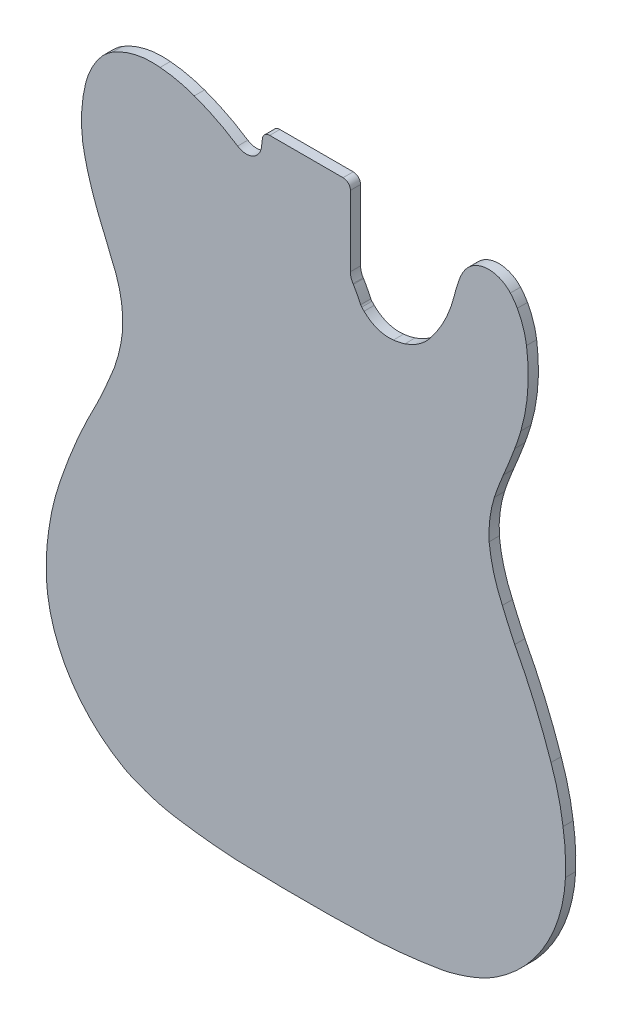
from build123d import *

# Parameters (mm, degrees)
EXTRUDE1_DEPTH     = 44.45
SKETCH8_W          = 820.295635457
SKETCH8_H          = 609.826953774
CUT_EXTRUDE1_DEPTH = 38.1


with BuildPart() as part:
    # Sketch2 → Extrude1 (new body)
    with BuildSketch(Plane.XY):
        with BuildLine():
            Line((236.701314765, -109.52926958), (237.322551245, -104.518285004))
            ThreePointArc((237.322551245, -104.518285004), (238.832324595, -101.654790046), (241.859816, -100.5087906))
            Line((241.859816, -100.5087906), (287.627187, -100.5087906))
            ThreePointArc((287.627187, -100.5087906), (290.860079204, -101.847898396), (292.199187, -105.0807906))
            Line((292.199187, -105.0807906), (292.199187, -149.0184218))
            ThreePointArc((292.199187, -149.0184218), (292.597958053, -151.927621282), (293.795193618, -154.608868562))
            ThreePointArc((293.795193618, -154.608868562), (293.913773723, -154.790051229), (294.036001367, -154.968793512))
            ThreePointArc((294.036001367, -154.968793512), (296.462850079, -159.222895043), (298.58610753, -163.636368995))
            ThreePointArc((298.58610753, -163.636368995), (298.881112709, -164.165143005), (299.271135507, -164.628297651))
            ThreePointArc((299.271135507, -164.628297651), (300.007264707, -165.356749106), (300.73644663, -166.092154739))
            ThreePointArc((300.73644663, -166.092154739), (309.134939866, -171.428010927), (319.025875401, -172.512189948))
            ThreePointArc((319.025875401, -172.512189948), (322.667874381, -171.899747758), (326.235195219, -170.94399463))
            ThreePointArc((326.235195219, -170.94399463), (334.736991182, -166.788776714), (341.69241097, -160.372507853))
            ThreePointArc((341.69241097, -160.372507853), (350.978860141, -145.938116384), (356.931481894, -129.839790708))
            ThreePointArc((356.931481894, -129.839790708), (358.444492908, -124.360678247), (360.217684146, -118.960153409))
            ThreePointArc((360.217684146, -118.960153409), (361.726955491, -115.496522091), (363.691265694, -112.269119525))
            ThreePointArc((363.691265694, -112.269119525), (377.452236791, -104.634981944), (392.000789341, -110.63364853))
            ThreePointArc((392.000789341, -110.63364853), (394.334174265, -113.548333419), (396.320318679, -116.709868421))
            ThreePointArc((396.320318679, -116.709868421), (399.985801408, -125.076496738), (402.069054575, -133.970106202))
            ThreePointArc((402.069054575, -133.970106202), (402.850473596, -158.142444635), (398.510836922, -181.934882814))
            ThreePointArc((398.510836922, -181.934882814), (396.712752953, -187.660630305), (394.711731045, -193.318651304))
            ThreePointArc((394.711731045, -193.318651304), (391.254221541, -202.284530505), (387.604313736, -211.173823775))
            ThreePointArc((387.604313736, -211.173823775), (384.645418623, -218.559200445), (381.97307243, -226.053025547))
            ThreePointArc((381.97307243, -226.053025547), (379.220115758, -238.701804496), (378.745605361, -251.638002516))
            ThreePointArc((378.745605361, -251.638002516), (381.624241727, -267.094911335), (387.005590994, -281.867983379))
            ThreePointArc((387.005590994, -281.867983379), (390.741696955, -290.562895178), (394.746018404, -299.137589848))
            ThreePointArc((394.746018404, -299.137589848), (407.105387056, -324.908404556), (417.355590006, -351.588401252))
            ThreePointArc((417.355590006, -351.588401252), (421.906718125, -366.822834456), (424.846419648, -382.448418515))
            ThreePointArc((424.846419648, -382.448418515), (426.249850723, -395.79034395), (426.367663828, -409.205362144))
            ThreePointArc((426.367663828, -409.205362144), (413.851256788, -452.11341389), (383.140740026, -484.58841212))
            ThreePointArc((383.140740026, -484.58841212), (376.726903694, -488.327090669), (369.979691238, -491.423885444))
            ThreePointArc((369.979691238, -491.423885444), (361.755548517, -494.399048058), (353.346112162, -496.801025635))
            ThreePointArc((353.346112162, -496.801025635), (351.598275163, -497.203126282), (349.837333504, -497.543278577))
            ThreePointArc((349.837333504, -497.543278577), (328.927692137, -500.563756073), (307.875617353, -502.337603226))
            ThreePointArc((307.875617353, -502.337603226), (264.647049723, -503.080365686), (221.41824861, -502.351318606))
            ThreePointArc((221.41824861, -502.351318606), (221.00580821, -502.335100706), (220.593567708, -502.314415619))
            ThreePointArc((220.593567708, -502.314415619), (201.284363819, -500.712124888), (182.091052494, -498.06080619))
            ThreePointArc((182.091052494, -498.06080619), (175.416754512, -496.721648206), (168.847112314, -494.938561263))
            ThreePointArc((168.847112314, -494.938561263), (162.119330737, -492.66041844), (155.529409804, -490.009772905))
            ThreePointArc((155.529409804, -490.009772905), (153.132812394, -488.891967619), (150.797631292, -487.650961163))
            ThreePointArc((150.797631292, -487.650961163), (116.491995751, -454.558228352), (102.514776867, -408.988030339))
            ThreePointArc((102.514776867, -408.988030339), (102.647448667, -395.681700976), (104.046018753, -382.448409448))
            ThreePointArc((104.046018753, -382.448409448), (106.98510575, -366.822864688), (111.535598588, -351.588400588))
            ThreePointArc((111.535598588, -351.588400588), (121.785921274, -324.908172846), (134.146411655, -299.137609307))
            ThreePointArc((134.146411655, -299.137609307), (138.150111982, -290.562902597), (141.885599861, -281.867999389))
            ThreePointArc((141.885599861, -281.867999389), (147.267652973, -267.095112393), (150.145582523, -251.638003757))
            ThreePointArc((150.145582523, -251.638003757), (148.821670426, -233.475790137), (143.036402463, -216.208786303))
            ThreePointArc((143.036402463, -216.208786303), (140.009349985, -208.5521602), (136.805998568, -200.967602883))
            ThreePointArc((136.805998568, -200.967602883), (133.075014503, -191.465363775), (129.82521382, -181.787988837))
            ThreePointArc((129.82521382, -181.787988837), (127.242537041, -172.460798588), (125.255618654, -162.988794966))
            ThreePointArc((125.255618654, -162.988794966), (124.573431659, -146.269657735), (127.035980496, -129.718803313))
            ThreePointArc((127.035980496, -129.718803313), (131.043720455, -119.123881134), (137.44559748, -109.77881152))
            ThreePointArc((137.44559748, -109.77881152), (140.408836969, -107.058482812), (143.665986338, -104.697984023))
            ThreePointArc((143.665986338, -104.697984023), (158.033642326, -98.861944673), (173.515606109, -97.968809036))
            ThreePointArc((173.515606109, -97.968809036), (184.337065562, -99.609972723), (194.84638863, -102.668000127))
            ThreePointArc((194.84638863, -102.668000127), (208.754429598, -108.681110615), (221.847962027, -116.306758775))
            ThreePointArc((221.847962027, -116.306758775), (231.168773326, -117.069146469), (236.701314765, -109.52926958))
        make_face()
    extrude(amount=EXTRUDE1_DEPTH)

    # Sketch8 → Cut-Extrude1 (cut)
    with BuildSketch(Plane(origin=(0, 0, 0), x_dir=(-1, 0, 0), z_dir=(0, 0, -1))):
        with Locations((-256.741670113, -315.378342919)):
            Rectangle(SKETCH8_W, SKETCH8_H)
    extrude(amount=-CUT_EXTRUDE1_DEPTH, mode=Mode.SUBTRACT)


solid = part.part
